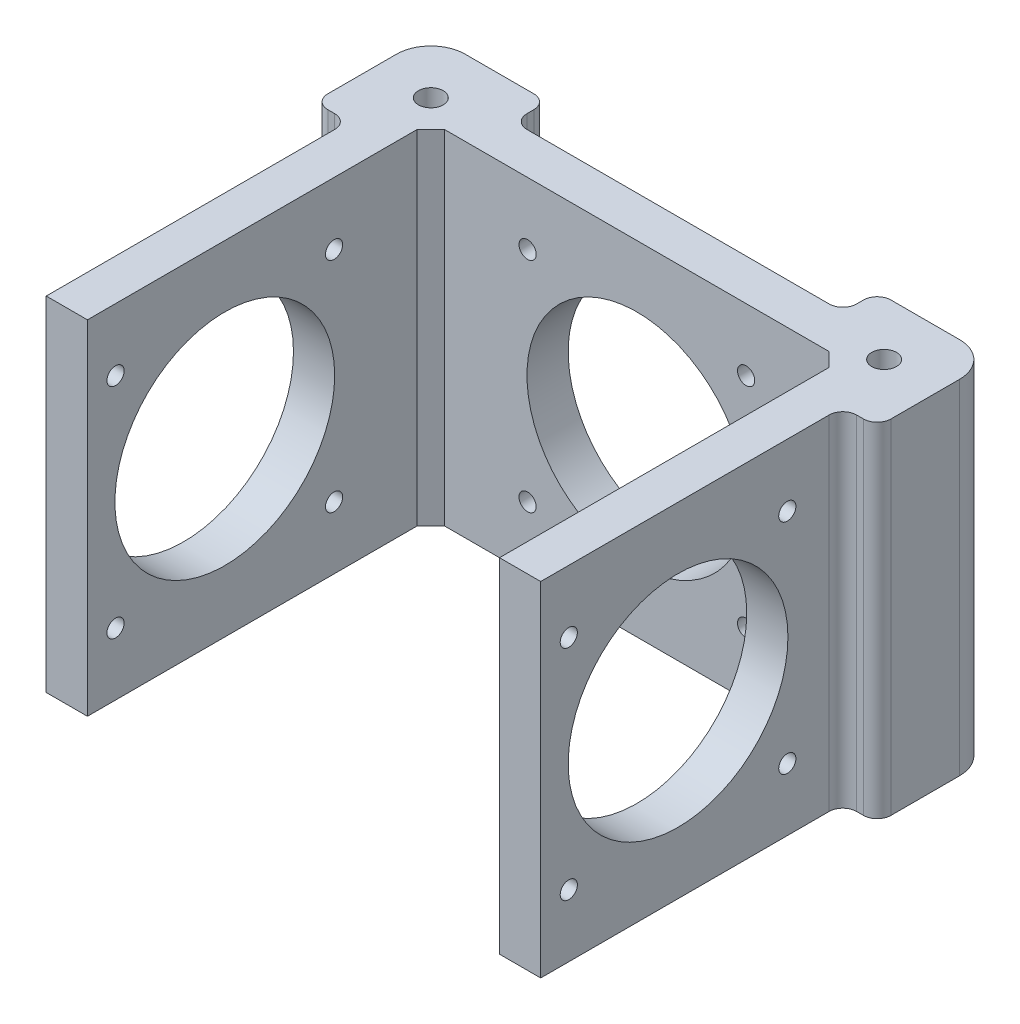
from build123d import *

# Parameters (mm, degrees)
BOSS_EXTRUDE1_DEPTH     = 50
CUT_EXTRUDE1_DEPTH      = 94.512708955
CUT_EXTRUDE1_DEPTH_BACK = 94.512708955
SKETCH2_R               = 16
SKETCH3_R               = 16
CUT_EXTRUDE2_DEPTH      = 93.736184955
TAP_DRILL_FOR_M3_TAP1_D = 2.5
TAP_DRILL_FOR_M3_TAP2_D = 2.5
CHAMFER1_SIZE           = 2
BOSS_EXTRUDE2_DEPTH     = 50
FILLET1_R               = 2
FILLET2_R               = 5
M3_CLEARANCE_HOLE1_D    = 3.6


with BuildPart() as part:
    # Sketch1 → Boss-Extrude1 (new body)
    with BuildSketch(Plane(origin=(0, 0, 0), x_dir=(1, 0, 0), z_dir=(0, 1, 0))):
        Polygon((-12, -43.458333333), (-6, -43.458333333), (-6, 6.541666667), (54, 6.541666667), (54, -43.458333333), (60, -43.458333333), (60, 12.541666667), (-12, 12.541666667), align=None)
    extrude(amount=BOSS_EXTRUDE1_DEPTH)

    # Sketch2 → Cut-Extrude1 (cut, two sides: drawn at the far end of the back side and taken through both)
    with BuildSketch(Plane(origin=(-6, 0, 0), x_dir=(0, 0, -1), z_dir=(1, 0, 0)).offset(-CUT_EXTRUDE1_DEPTH_BACK)):
        with Locations((-23.458333333, 25)):
            Circle(SKETCH2_R)
    extrude(amount=CUT_EXTRUDE1_DEPTH + CUT_EXTRUDE1_DEPTH_BACK, mode=Mode.SUBTRACT)

    # Sketch3 → Cut-Extrude2 (cut, through all)
    with BuildSketch(Plane.XY.offset(-6.541666667)):
        with Locations((24, 25)):
            Circle(SKETCH3_R)
    extrude(amount=-CUT_EXTRUDE2_DEPTH, mode=Mode.SUBTRACT)

    # Tap Drill for M3 Tap1 (through all)
    with Locations(Plane(origin=(60, 0, 0), x_dir=(0, 0, -1), z_dir=(1, 0, 0))):
        with Locations((-39.36823591, 9.090097423), (-39.36823591, 40.909902577), (-7.548430757, 40.909902577), (-7.548430757, 9.090097423)):
            Hole(TAP_DRILL_FOR_M3_TAP1_D / 2)

    # Tap Drill for M3 Tap2 (through all)
    with Locations(Plane(origin=(0, 0, -12.541666667), x_dir=(-1, 0, 0), z_dir=(0, 0, -1))):
        with Locations((-39.909902577, 9.090097423), (-39.909902577, 40.909902577), (-8.090097423, 40.909902577), (-8.090097423, 9.090097423)):
            Hole(TAP_DRILL_FOR_M3_TAP2_D / 2)

    # Chamfer1
    chamfer1_edges = [part.edges().sort_by_distance(p)[0] for p in [
        (54, 25, -6.541666667),
        (-6, 25, -6.541666667),
    ]]
    chamfer(chamfer1_edges, length=CHAMFER1_SIZE)

    # Sketch9 → Boss-Extrude2 (add)
    with BuildSketch(Plane(origin=(0, 50, 0), x_dir=(1, 0, 0), z_dir=(0, 1, 0))):
        Polygon((-12, 0.541666667), (-17, 0.541666667), (-17, 17.541666667), (0, 17.541666667), (0, 12.541666667), (-12, 12.541666667), align=None)
        Polygon((65, 17.541666667), (65, 0.541666667), (60, 0.541666667), (60, 12.541666667), (48, 12.541666667), (48, 17.541666667), align=None)
    extrude(amount=-BOSS_EXTRUDE2_DEPTH)

    # Fillet1
    fillet1_edges = [part.edges().sort_by_distance(p)[0] for p in [
        (-12, 25, -0.541666667),
        (-17, 25, -0.541666667),
        (0, 25, -17.541666667),
        (0, 25, -12.541666667),
        (48, 25, -17.541666667),
        (65, 25, -0.541666667),
        (60, 25, -0.541666667),
        (48, 25, -12.541666667),
    ]]
    fillet(fillet1_edges, radius=FILLET1_R)

    # Fillet2
    fillet2_edges = [part.edges().sort_by_distance(p)[0] for p in [
        (-17, 25, -17.541666667),
        (65, 25, -17.541666667),
    ]]
    fillet(fillet2_edges, radius=FILLET2_R)

    # M3 Clearance Hole1 (through all)
    with Locations(Plane(origin=(0, 50, 0), x_dir=(1, 0, 0), z_dir=(0, 1, 0))):
        with Locations((-9, 9.541666667), (57, 9.541666667)):
            Hole(M3_CLEARANCE_HOLE1_D / 2)


solid = part.part
